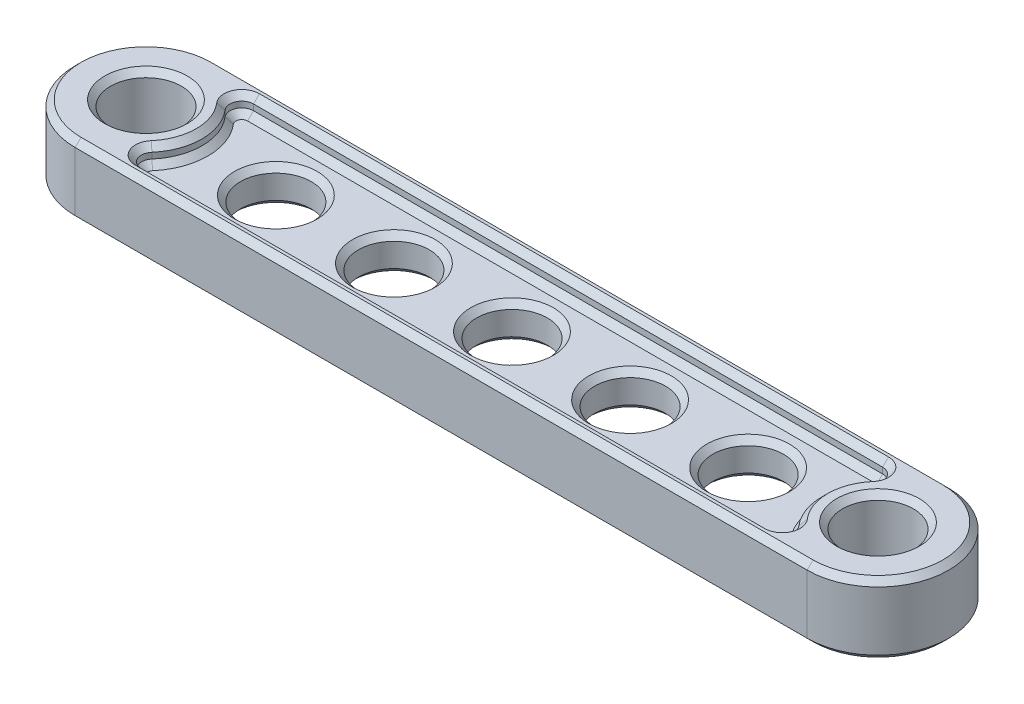
from build123d import *

# Parameters (mm, degrees)
SKETCH1_R           = 3
BOSS_EXTRUDE1_DEPTH = 3
CUT_EXTRUDE1_START  = 1.5
CUT_EXTRUDE1_DEPTH  = 6
CUT_EXTRUDE2_START  = -7.5
CUT_EXTRUDE2_DEPTH  = 6
CHAMFER1_SIZE       = 0.5


with BuildPart() as part:
    # Sketch1 → Boss-Extrude1 (new, symmetric)
    with BuildSketch(Plane(origin=(0, 0, 0), x_dir=(1, 0, 0), z_dir=(0, 1, 0))):
        with BuildLine():
            Line((-31, 6), (31, 6))
            ThreePointArc((31, 6), (37, 0), (31, -6))
            Line((31, -6), (-31, -6))
            ThreePointArc((-31, -6), (-37, 0), (-31, 6))
        make_face()
        with Locations((-31, 0)):
            Circle(SKETCH1_R, mode=Mode.SUBTRACT)
        with Locations((31, 0)):
            Circle(SKETCH1_R, mode=Mode.SUBTRACT)
        Circle(SKETCH1_R, mode=Mode.SUBTRACT)
        with Locations((10, 0)):
            Circle(SKETCH1_R, mode=Mode.SUBTRACT)
        with Locations((20, 0)):
            Circle(SKETCH1_R, mode=Mode.SUBTRACT)
        with Locations((-20, 0)):
            Circle(SKETCH1_R, mode=Mode.SUBTRACT)
        with Locations((-10, 0)):
            Circle(SKETCH1_R, mode=Mode.SUBTRACT)
    extrude(amount=BOSS_EXTRUDE1_DEPTH, both=True)

    # Sketch2 → Cut-Extrude1 (cut)
    with BuildSketch(Plane(origin=(0, 0, 0), x_dir=(1, 0, 0), z_dir=(0, 1, 0)).offset(CUT_EXTRUDE1_START)):
        with BuildLine():
            Line((-26.641101056, 4.75), (26.641101056, 4.75))
            ThreePointArc((26.641101056, 4.75), (27.549994316, 4.167028828), (27.399170438, 3.097826087))
            ThreePointArc((27.399170438, 3.097826087), (26.25, 0), (27.399170438, -3.097826087))
            ThreePointArc((27.399170438, -3.097826087), (27.549994316, -4.167028828), (26.641101056, -4.75))
            Line((26.641101056, -4.75), (-26.641101056, -4.75))
            ThreePointArc((-26.641101056, -4.75), (-27.549994316, -4.167028828), (-27.399170438, -3.097826087))
            ThreePointArc((-27.399170438, -3.097826087), (-26.25, 0), (-27.399170438, 3.097826087))
            ThreePointArc((-27.399170438, 3.097826087), (-27.549994316, 4.167028828), (-26.641101056, 4.75))
        make_face()
    extrude(amount=CUT_EXTRUDE1_DEPTH, mode=Mode.SUBTRACT)

    # Sketch2<2> → Cut-Extrude2 (cut)
    with BuildSketch(Plane(origin=(0, 0, 0), x_dir=(1, 0, 0), z_dir=(0, 1, 0)).offset(CUT_EXTRUDE2_START)):
        with BuildLine():
            Line((-26.641101056, 4.75), (26.641101056, 4.75))
            ThreePointArc((26.641101056, 4.75), (27.549994316, 4.167028828), (27.399170438, 3.097826087))
            ThreePointArc((27.399170438, 3.097826087), (26.25, 0), (27.399170438, -3.097826087))
            ThreePointArc((27.399170438, -3.097826087), (27.549994316, -4.167028828), (26.641101056, -4.75))
            Line((26.641101056, -4.75), (-26.641101056, -4.75))
            ThreePointArc((-26.641101056, -4.75), (-27.549994316, -4.167028828), (-27.399170438, -3.097826087))
            ThreePointArc((-27.399170438, -3.097826087), (-26.25, 0), (-27.399170438, 3.097826087))
            ThreePointArc((-27.399170438, 3.097826087), (-27.549994316, 4.167028828), (-26.641101056, 4.75))
        make_face()
    extrude(amount=CUT_EXTRUDE2_DEPTH, mode=Mode.SUBTRACT)

    # Chamfer1
    chamfer1_edges = [part.edges().sort_by_distance(p)[0] for p in [
        (-26.25, -1.5, 0),
        (-27.549994316, -1.5, 4.167028828),
        (0, -1.5, 4.75),
        (27.549994316, -1.5, 4.167028828),
        (26.25, -1.5, 0),
        (27.549994316, -1.5, -4.167028828),
        (0, -1.5, -4.75),
        (-27.549994316, -1.5, -4.167028828),
        (-13, -1.5, 0),
        (-23, -1.5, 0),
        (17, -1.5, 0),
        (7, -1.5, 0),
        (-3, -1.5, 0),
        (0, 1.5, -4.75),
        (27.549994316, 1.5, -4.167028828),
        (26.25, 1.5, 0),
        (27.549994316, 1.5, 4.167028828),
        (0, 1.5, 4.75),
        (-27.549994316, 1.5, 4.167028828),
        (-26.25, 1.5, 0),
        (-27.549994316, 1.5, -4.167028828),
        (-13, 1.5, 0),
        (-23, 1.5, 0),
        (17, 1.5, 0),
        (7, 1.5, 0),
        (-3, 1.5, 0),
        (27.549994316, -3, -4.167028828),
        (26.25, -3, 0),
        (27.549994316, -3, 4.167028828),
        (0, -3, 4.75),
        (-27.549994316, -3, 4.167028828),
        (-26.25, -3, 0),
        (-27.549994316, -3, -4.167028828),
        (0, -3, -4.75),
        (0, -3, 6),
        (37, -3, 0),
        (0, -3, -6),
        (-37, -3, 0),
        (-34, -3, 0),
        (28, -3, 0),
        (-27.549994316, 3, 4.167028828),
        (0, 3, 4.75),
        (27.549994316, 3, 4.167028828),
        (26.25, 3, 0),
        (27.549994316, 3, -4.167028828),
        (0, 3, -4.75),
        (-27.549994316, 3, -4.167028828),
        (-26.25, 3, 0),
        (28, 3, 0),
        (0, 3, -6),
        (37, 3, 0),
        (0, 3, 6),
        (-37, 3, 0),
        (-34, 3, 0),
    ]]
    chamfer(chamfer1_edges, length=CHAMFER1_SIZE)


solid = part.part
